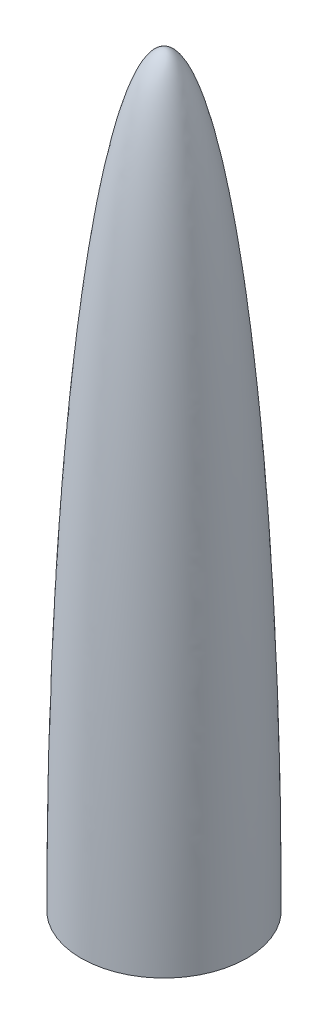
from build123d import *


with BuildPart() as part:
    # Sketch2 → Revolve1 (revolve)
    with BuildSketch(Plane(origin=(0, 0, 0), x_dir=(0, 0, -1), z_dir=(1, 0, 0))):
        with BuildLine():
            Line((0, 228.6), (0, 227.33))
            add(Edge.make_bspline(
                [(24.13, 0), (24.13, 227.33), (0, 227.33)],
                knots=[4.71238898, 4.71238898, 4.71238898, 6.283185307, 6.283185307, 6.283185307], degree=2, weights=[1, 0.707106781, 1]))
            Line((24.13, 0), (25.4, 0))
            add(Edge.make_bspline(
                [(25.4, 0), (25.4, 228.6), (0, 228.6)],
                knots=[4.71238898, 4.71238898, 4.71238898, 6.283185307, 6.283185307, 6.283185307], degree=2, weights=[1, 0.707106781, 1]))
        make_face()
    revolve(axis=Axis((0, 0, 0), (0, 1, 0)))


solid = part.part
